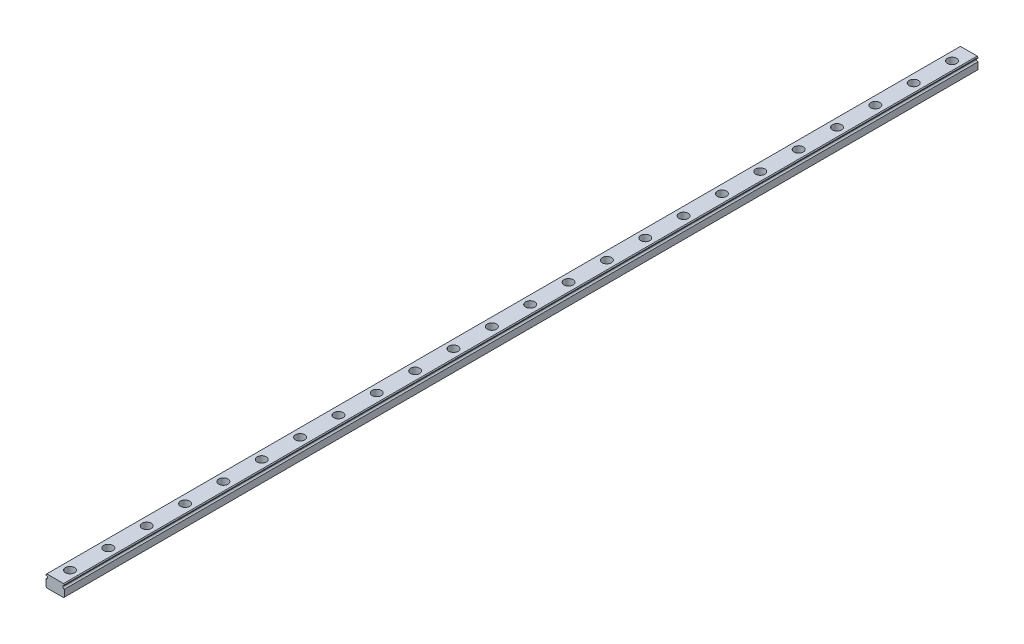
from build123d import *

# Parameters (mm, degrees)
BOSS_EXTRUDE1_DEPTH                     = 598
CBORE_FOR_M5_HEX_HEAD_BOLT1_D           = 3.5
CBORE_FOR_M5_HEX_HEAD_BOLT1_CBORE_D     = 6
CBORE_FOR_M5_HEX_HEAD_BOLT1_CBORE_DEPTH = 4.5
LPATTERN1_COUNT                         = 24
LPATTERN1_PITCH                         = 25.1


with BuildPart() as part:
    # Sketch1 → Boss-Extrude1 (new body)
    with BuildSketch(Plane.XY):
        with BuildLine():
            Line((0, 4), (-5.5, 4))
            Line((-5.5, 4), (-6, 3.5))
            Line((-6, 3.5), (-6, 3))
            ThreePointArc((-6, 3), (-5, 2), (-6, 1))
            Line((-6, 1), (-6, -3.5))
            Line((-6, -3.5), (-5.5, -4))
            Line((-5.5, -4), (5.5, -4))
            Line((5.5, -4), (6, -3.5))
            Line((6, -3.5), (6, 1))
            ThreePointArc((6, 1), (5, 2), (6, 3))
            Line((6, 3), (6, 3.5))
            Line((6, 3.5), (5.5, 4))
            Line((5.5, 4), (0, 4))
        make_face()
    extrude(amount=BOSS_EXTRUDE1_DEPTH)

    # CBORE for M5 Hex Head Bolt1 (through all)
    with Locations(Plane(origin=(0, 4, 0), x_dir=(1, 0, 0), z_dir=(0, 1, 0))):
        with Locations((0, -11)):
            cbore_for_m5_hex_head_bolt1 = CounterBoreHole(CBORE_FOR_M5_HEX_HEAD_BOLT1_D / 2, CBORE_FOR_M5_HEX_HEAD_BOLT1_CBORE_D / 2, CBORE_FOR_M5_HEX_HEAD_BOLT1_CBORE_DEPTH)

    # LPattern1: CBORE for M5 Hex Head Bolt1 ×24
    with Locations(*[(0, 0, i * LPATTERN1_PITCH) for i in range(1, LPATTERN1_COUNT)]):
        add(cbore_for_m5_hex_head_bolt1, mode=Mode.SUBTRACT)


solid = part.part
